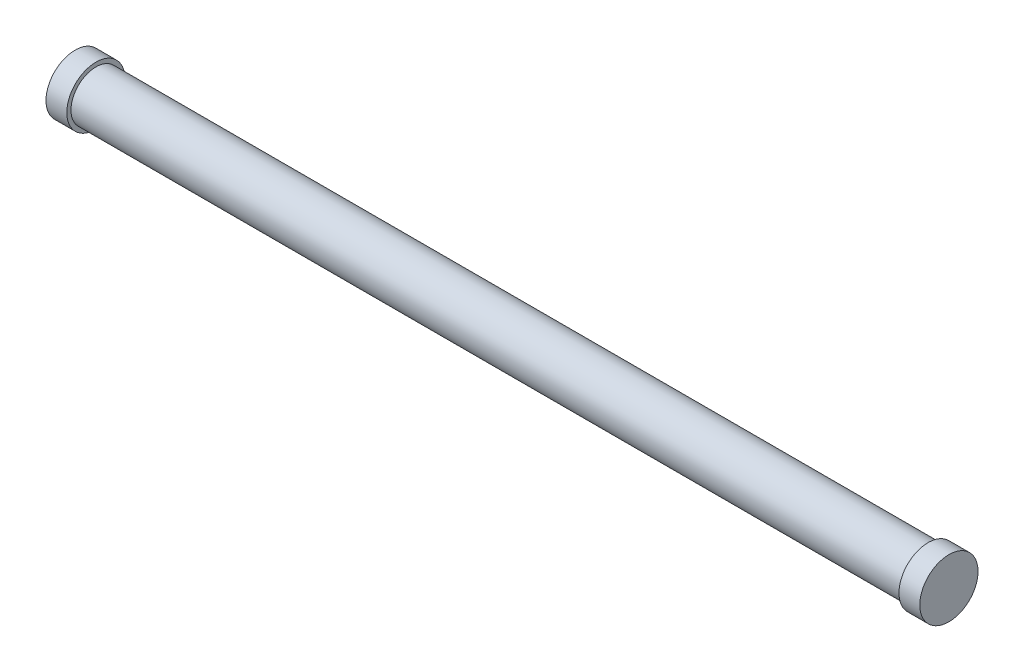
from build123d import *

# Parameters (mm, degrees)
SKETCH1_W           = 200
SKETCH1_H           = 6
SKETCH2_R           = 7
BOSS_EXTRUDE1_DEPTH = 5


with BuildPart() as part:
    # Sketch1 → Revolve1 (revolve)
    with BuildSketch(Plane(origin=(0, 0, 0), x_dir=(1, 0, 0), z_dir=(0, 1, 0)), mode=Mode.PRIVATE) as revolve1_sk:
        with Locations((65.279538905, 9)):
            Rectangle(SKETCH1_W, SKETCH1_H)
    revolve(revolve1_sk.sketch.rotate(Axis((-34.720461095, 0, -6), (1, 0, 0)), 180), axis=Axis((-34.720461095, 0, -6), (1, 0, 0)))

    # Sketch2 → Boss-Extrude1 (add)
    with BuildSketch(Plane.ZY.offset(34.720461095)):
        with Locations((-6, 0)):
            Circle(SKETCH2_R)
    boss_extrude1 = extrude(amount=BOSS_EXTRUDE1_DEPTH)

    # Mirror1: Boss-Extrude1 across plane
    add(boss_extrude1.mirror(Plane(origin=(65.279538905, 0, 0), x_dir=(0, 0, 1), z_dir=(1, 0, 0))))


solid = part.part
